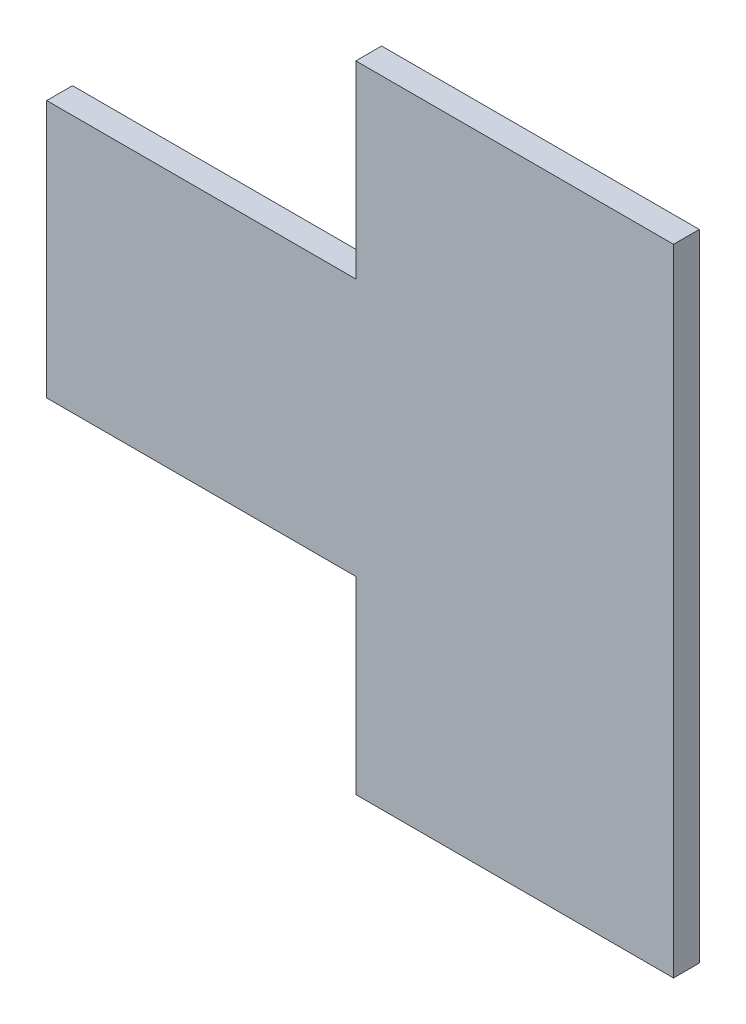
from build123d import *

# Parameters (mm, degrees)
EXTRUDE_1_DEPTH = 3


with BuildPart() as part:
    # 草图1 → 凸台-拉伸1 (new body)
    with BuildSketch(Plane.XY):
        Polygon((0, 0), (36, 0), (36, 22), (73, 22), (73, -52), (36, -52), (36, -30), (0, -30), align=None)
    extrude(amount=EXTRUDE_1_DEPTH)


solid = part.part
